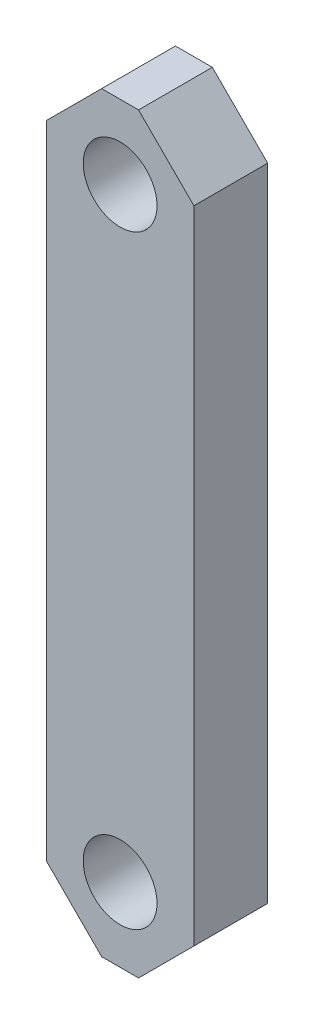
from build123d import *

# Parameters (mm, degrees)
SKETCH1_W          = 50.8
SKETCH1_H          = 258.7625
SKETCH1_R          = 12.7
EXTRUDE1_DEPTH     = 12.7
CUT_EXTRUDE1_DEPTH = 135.275194476


with BuildPart() as part:
    # Sketch1 → Extrude1 (new, symmetric)
    with BuildSketch(Plane.XY):
        Rectangle(SKETCH1_W, SKETCH1_H)
        with Locations((0, 103.98125)):
            Circle(SKETCH1_R, mode=Mode.SUBTRACT)
        with Locations((0, -103.98125)):
            Circle(SKETCH1_R, mode=Mode.SUBTRACT)
    extrude(amount=EXTRUDE1_DEPTH, both=True)

    # Sketch2 → Cut-Extrude1 (cut, through all)
    with BuildSketch(Plane.XY.offset(12.7)):
        Polygon((-6.35, 129.38125), (-25.4, 110.33125), (-25.4, 129.38125), align=None)
        Polygon((6.35, 129.38125), (25.4, 110.33125), (25.4, 129.38125), align=None)
        Polygon((-25.4, -110.33125), (-6.35, -129.38125), (-25.4, -129.38125), align=None)
        Polygon((25.4, -110.33125), (25.4, -129.38125), (6.35, -129.38125), align=None)
    extrude(amount=-CUT_EXTRUDE1_DEPTH, mode=Mode.SUBTRACT)


solid = part.part
